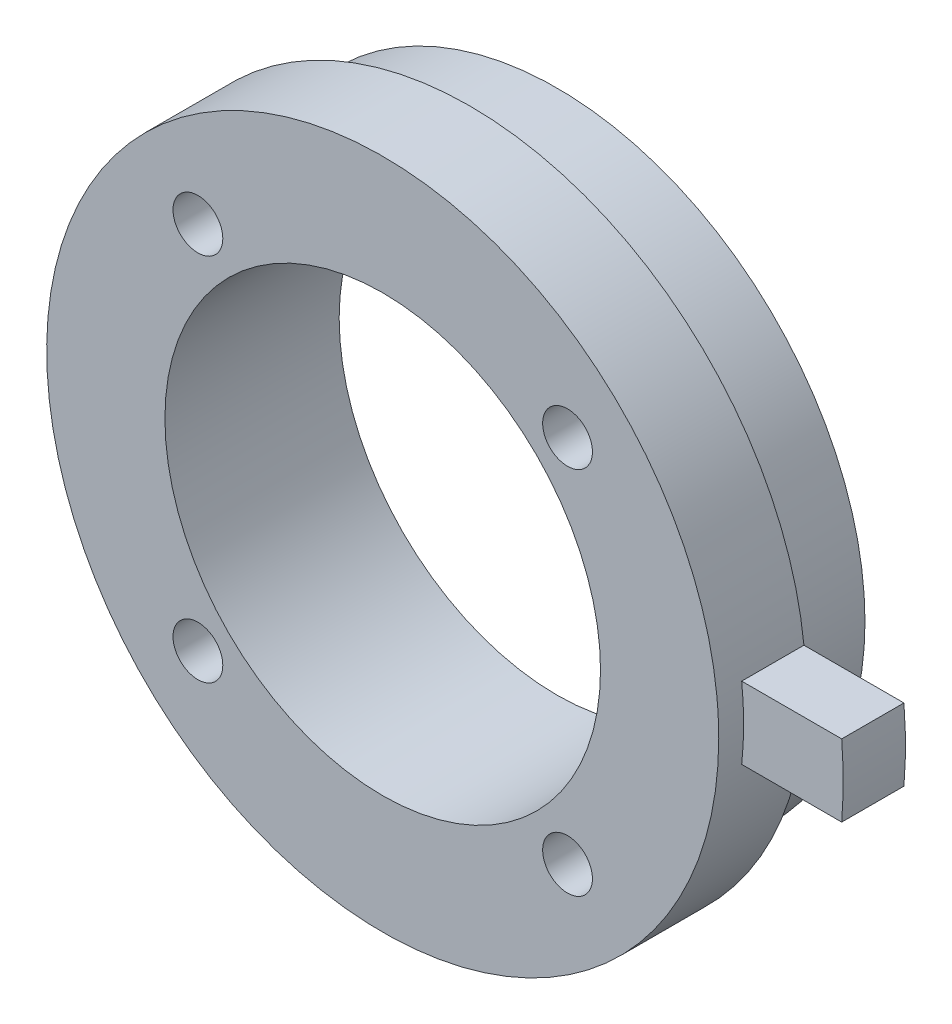
from build123d import *

# Parameters (mm, degrees)
SKETCH_1_R          = 24.75
SKETCH_1_R_2        = 17.5
EXTRUDE_1_DEPTH     = 3.5
SKETCH_2_R          = 27
SKETCH_2_R_2        = 17.5
EXTRUDE_2_DEPTH     = 7
SKETCH_3_R          = 2
CUT_EXTRUDE_1_DEPTH = 15
EXTRUDE_3_DEPTH     = 5


with BuildPart() as part:
    # 草图1 → 凸台-拉伸1 (new, symmetric)
    with BuildSketch(Plane.XY):
        Circle(SKETCH_1_R)
        Circle(SKETCH_1_R_2, mode=Mode.SUBTRACT)
    extrude(amount=EXTRUDE_1_DEPTH, both=True)

    # 草图2 → 凸台-拉伸2 (add)
    with BuildSketch(Plane.XY.offset(3.5)):
        Circle(SKETCH_2_R)
        Circle(SKETCH_2_R_2, mode=Mode.SUBTRACT)
    extrude(amount=EXTRUDE_2_DEPTH)

    # 草图3 → 切除-拉伸1 (cut)
    with BuildSketch(Plane(origin=(0, 0, -3.5), x_dir=(-1, 0, 0), z_dir=(0, 0, -1))):
        with Locations((14.849242405, 14.849242405)):
            Circle(SKETCH_3_R)
        with Locations((14.849242405, -14.849242405)):
            Circle(SKETCH_3_R)
        with Locations((-14.849242405, -14.849242405)):
            Circle(SKETCH_3_R)
        with Locations((-14.849242405, 14.849242405)):
            Circle(SKETCH_3_R)
    extrude(amount=-CUT_EXTRUDE_1_DEPTH, mode=Mode.SUBTRACT)

    # 草图4 → 凸台-拉伸3 (add)
    with BuildSketch(Plane(origin=(0, 0, 3.5), x_dir=(-1, 0, 0), z_dir=(0, 0, -1))):
        with BuildLine():
            ThreePointArc((27, 0), (1.450134249, 26.961029481), (-26.844230419, 2.896082389))
            Line((-26.844230419, 2.896082389), (-24.579975728, 2.896082389))
            ThreePointArc((-24.579975728, 2.896082389), (1.45053451, 24.707457369), (24.75, 0))
            ThreePointArc((24.75, 0), (1.45053451, -24.707457369), (-24.579975728, -2.896082389))
            Line((-24.579975728, -2.896082389), (-26.844230419, -2.896082389))
            ThreePointArc((-26.844230419, -2.896082389), (1.450134249, -26.961029481), (27, 0))
        make_face()
        with BuildLine():
            Line((-24.579975728, 2.896082389), (-26.844230419, 2.896082389))
            ThreePointArc((-26.844230419, 2.896082389), (-27, 0), (-26.844230419, -2.896082389))
            Line((-26.844230419, -2.896082389), (-24.579975728, -2.896082389))
            ThreePointArc((-24.579975728, -2.896082389), (-24.75, 0), (-24.579975728, 2.896082389))
        make_face()
        with BuildLine():
            Line((-26.844230419, 2.896082389), (-34.879975728, 2.896082389))
            ThreePointArc((-34.879975728, 2.896082389), (-35, 0), (-34.879975728, -2.896082389))
            Line((-34.879975728, -2.896082389), (-26.844230419, -2.896082389))
            ThreePointArc((-26.844230419, -2.896082389), (-27, 0), (-26.844230419, 2.896082389))
        make_face()
    extrude(amount=-EXTRUDE_3_DEPTH)


solid = part.part
